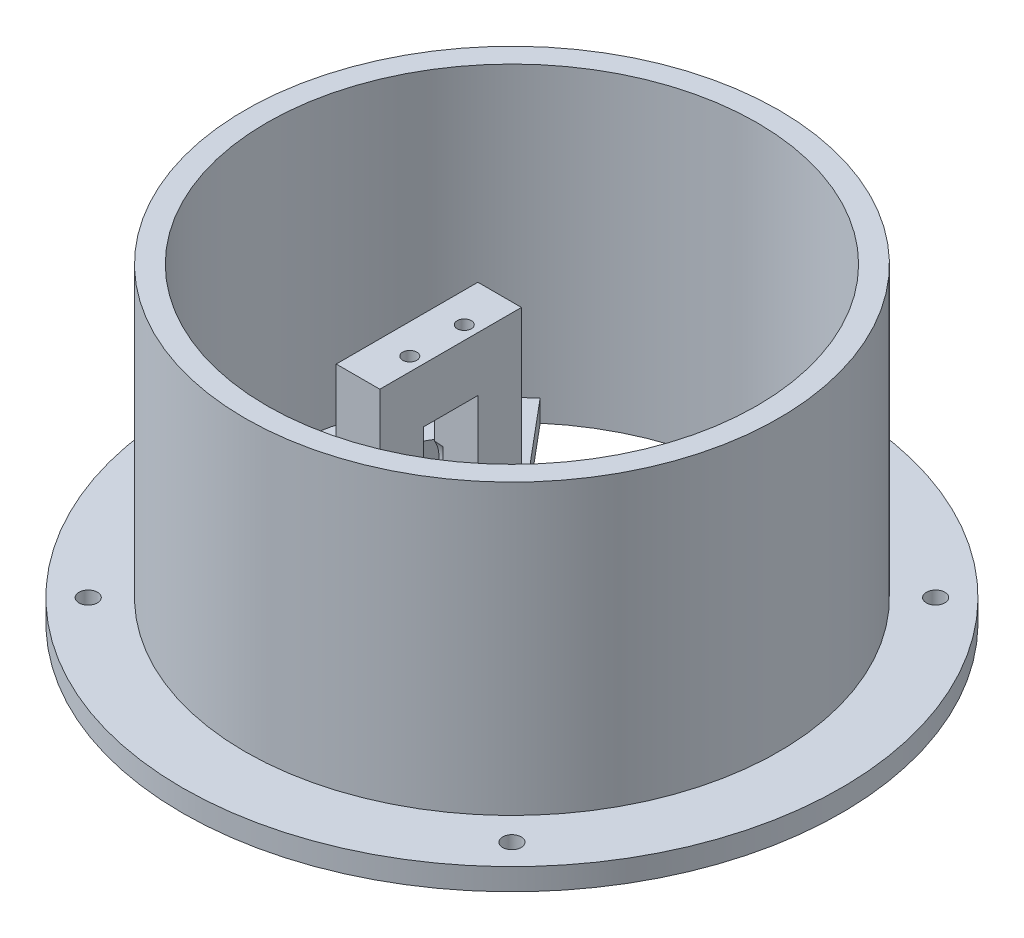
from build123d import *

# Parameters (mm, degrees)
SKETCH1_R           = 60.5
SKETCH1_R_2         = 1.7
BOSS_EXTRUDE1_DEPTH = 4
SKETCH2_R           = 49
SKETCH2_R_2         = 45
BOSS_EXTRUDE2_DEPTH = 53
SKETCH3_W           = 8
SKETCH3_H           = 26
BOSS_EXTRUDE3_DEPTH = 1
SKETCH4_W           = 8
SKETCH4_H           = 8
BOSS_EXTRUDE4_DEPTH = 23
SKETCH5_W           = 8
SKETCH5_H           = 26
BOSS_EXTRUDE5_DEPTH = 10
SKETCH6_R           = 1.3
CUT_EXTRUDE1_DEPTH  = 5
BOSS_EXTRUDE6_START = -10
SKETCH7_R           = 1.3
BOSS_EXTRUDE6_DEPTH = 10
SKETCH12_R          = 1.3
BOSS_EXTRUDE8_DEPTH = 5
RIB4_REACH          = 104.808
SKETCH17_WALL_W     = 226.415050864
SKETCH17_WALL_H     = 26
SKETCH18_R          = 5
CUT_EXTRUDE3_DEPTH  = 21


with BuildPart() as part:
    # Sketch1 → Boss-Extrude1 (new body)
    with BuildSketch(Plane(origin=(0, 0, 0), x_dir=(-1, 0, 0), z_dir=(0, 1, 0))):
        Circle(SKETCH1_R)
        with Locations((38.890872965, 38.890872965)):
            Circle(SKETCH1_R_2, mode=Mode.SUBTRACT)
        with Locations((38.890872965, -38.890872965)):
            Circle(SKETCH1_R_2, mode=Mode.SUBTRACT)
        with Locations((-38.890872965, -38.890872965)):
            Circle(SKETCH1_R_2, mode=Mode.SUBTRACT)
        with Locations((-38.890872965, 38.890872965)):
            Circle(SKETCH1_R_2, mode=Mode.SUBTRACT)
        with BuildLine():
            Line((11.25, -13), (11.25, 13))
            Line((11.25, 13), (29.125473669, 34.303159964))
            ThreePointArc((29.125473669, 34.303159964), (-45, 0), (29.125473669, -34.303159964))
            Line((29.125473669, -34.303159964), (11.25, -13))
        make_face(mode=Mode.SUBTRACT)
        with BuildLine():
            Line((24.25, -16), (24.25, 16))
            Line((24.25, 16), (29.530226152, 22.292728487))
            ThreePointArc((29.530226152, 22.292728487), (37, 0), (29.530226152, -22.292728487))
            Line((29.530226152, -22.292728487), (24.25, -16))
        make_face(mode=Mode.SUBTRACT)
    extrude(amount=BOSS_EXTRUDE1_DEPTH)

    # Sketch2 → Boss-Extrude2 (add)
    with BuildSketch(Plane(origin=(0, 4, 0), x_dir=(1, 0, 0), z_dir=(0, 1, 0))):
        Circle(SKETCH2_R)
        Circle(SKETCH2_R_2, mode=Mode.SUBTRACT)
    extrude(amount=BOSS_EXTRUDE2_DEPTH)

    # Sketch3 → Boss-Extrude3 (add)
    with BuildSketch(Plane(origin=(0, 4, 0), x_dir=(1, 0, 0), z_dir=(0, 1, 0))):
        with Locations((-15.25, 0)):
            Rectangle(SKETCH3_W, SKETCH3_H)
    extrude(amount=BOSS_EXTRUDE3_DEPTH)

    # Sketch4 → Boss-Extrude4 (add)
    with BuildSketch(Plane(origin=(0, 5, 0), x_dir=(1, 0, 0), z_dir=(0, 1, 0))):
        with Locations((-15.25, 9)):
            Rectangle(SKETCH4_W, SKETCH4_H)
        with Locations((-15.25, -9)):
            Rectangle(SKETCH4_W, SKETCH4_H)
    extrude(amount=BOSS_EXTRUDE4_DEPTH)

    # Sketch5 → Boss-Extrude5 (add)
    with BuildSketch(Plane(origin=(0, 28, 0), x_dir=(1, 0, 0), z_dir=(0, 1, 0))):
        with Locations((-15.25, 0)):
            Rectangle(SKETCH5_W, SKETCH5_H)
    extrude(amount=BOSS_EXTRUDE5_DEPTH)

    # Sketch6 → Cut-Extrude1 (cut)
    with BuildSketch(Plane(origin=(0, 38, 0), x_dir=(1, 0, 0), z_dir=(0, 1, 0))):
        with Locations((-13.75, 5)):
            Circle(SKETCH6_R)
        with Locations((-13.75, -5)):
            Circle(SKETCH6_R)
    extrude(amount=-CUT_EXTRUDE1_DEPTH, mode=Mode.SUBTRACT)

    # Sketch7 → Boss-Extrude6 (add)
    with BuildSketch(Plane(origin=(0, 38, 0), x_dir=(1, 0, 0), z_dir=(0, 1, 0)).offset(BOSS_EXTRUDE6_START)):
        with BuildLine():
            Line((31.75, 13), (31.75, -13))
            Line((31.75, -13), (47.244047244, -13))
            ThreePointArc((47.244047244, -13), (49, 0), (47.244047244, 13))
            Line((47.244047244, 13), (31.75, 13))
        make_face()
        with Locations((34.25, 5)):
            Circle(SKETCH7_R, mode=Mode.SUBTRACT)
        with Locations((34.25, -5)):
            Circle(SKETCH7_R, mode=Mode.SUBTRACT)
    extrude(amount=BOSS_EXTRUDE6_DEPTH)

    # Sketch12 → Boss-Extrude8 (add)
    with BuildSketch(Plane(origin=(0, 28, 0), x_dir=(-1, 0, 0), z_dir=(0, -1, 0))):
        with Locations((-34.25, 5)):
            Circle(SKETCH12_R)
        with Locations((-34.25, -5)):
            Circle(SKETCH12_R)
    extrude(amount=-BOSS_EXTRUDE8_DEPTH)

    # Sketch17 wall → Rib4 (add, up to next)
    with BuildSketch(Plane(origin=(37.415659229, 20.5, 0), x_dir=(0.602764856689, -0.797918872781, 0), z_dir=(-0.797918872781, -0.602764856689, 0)), mode=Mode.PRIVATE) as rib4_sk1:
        Rectangle(SKETCH17_WALL_W, SKETCH17_WALL_H)
    rib4_tool1 = extrude(rib4_sk1.sketch, amount=-RIB4_REACH, mode=Mode.PRIVATE) - part.part
    add(rib4_tool1.solids().sort_by_distance((37.415659229, 20.5, 0))[0])

    # Sketch18 → Cut-Extrude3 (cut)
    with BuildSketch(Plane(origin=(-38.816562471, 0, -1.698375091), x_dir=(0, 1, 0), z_dir=(0.999044171294917, 0, 0.043712055564257474))):
        with Locations((14, 0)):
            Circle(SKETCH18_R)
    extrude(amount=CUT_EXTRUDE3_DEPTH, mode=Mode.SUBTRACT)


solid = part.part
